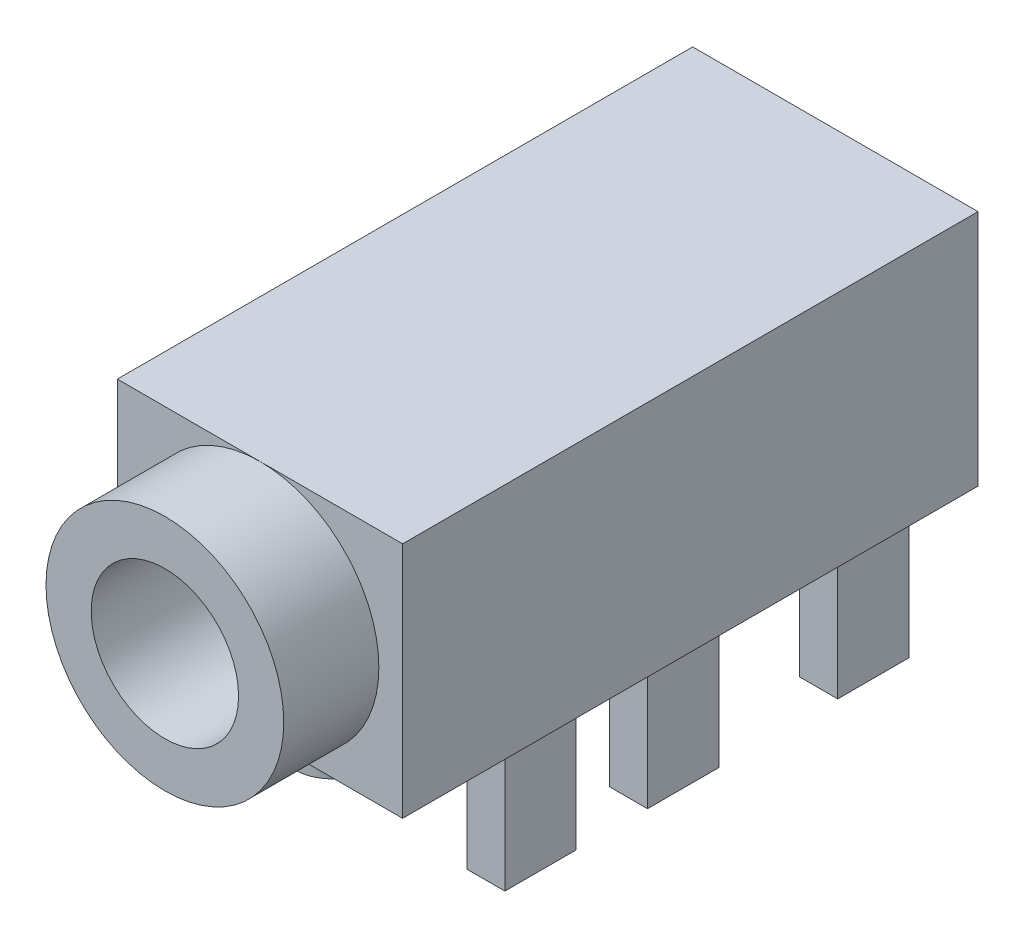
from build123d import *

# Parameters (mm, degrees)
SKETCH1_W           = 6
SKETCH1_H           = 12.1
BOSS_EXTRUDE1_DEPTH = 5
SKETCH2_R           = 2.5
BOSS_EXTRUDE2_DEPTH = 2
SKETCH4_W           = 0.8
SKETCH4_H           = 1.5
BOSS_EXTRUDE3_DEPTH = 2.8
SKETCH5_R           = 0.75
BOSS_EXTRUDE4_DEPTH = 1
SKETCH6_R           = 1.55
CUT_EXTRUDE1_DEPTH  = 10


with BuildPart() as part:
    # Sketch1 → Boss-Extrude1 (new body)
    with BuildSketch(Plane(origin=(0, 0, 0), x_dir=(1, 0, 0), z_dir=(0, 1, 0))):
        Rectangle(SKETCH1_W, SKETCH1_H)
    extrude(amount=BOSS_EXTRUDE1_DEPTH)

    # Sketch2 → Boss-Extrude2 (add)
    with BuildSketch(Plane.XY.offset(6.05)):
        with Locations(Location((0, 2.5, 0), (0, 0, 270))):
            Circle(SKETCH2_R)
    extrude(amount=BOSS_EXTRUDE2_DEPTH)

    # Sketch4 → Boss-Extrude3 (add)
    with BuildSketch(Plane.XZ):
        with Locations((2.2, 2.75)):
            Rectangle(SKETCH4_W, SKETCH4_H)
        with Locations((2.2, -0.25)):
            Rectangle(SKETCH4_W, SKETCH4_H)
        with Locations((2.2, -4.25)):
            Rectangle(SKETCH4_W, SKETCH4_H)
        with Locations((-2.2, -5.55)):
            Rectangle(SKETCH4_W, SKETCH4_H)
    extrude(amount=BOSS_EXTRUDE3_DEPTH)

    # Sketch5 → Boss-Extrude4 (add)
    with BuildSketch(Plane.XZ):
        with Locations(Location((0, 4.55, 0), (0, 0, 90))):
            Circle(SKETCH5_R)
        with Locations(Location((0, -2.45, 0), (0, 0, 90))):
            Circle(SKETCH5_R)
    extrude(amount=BOSS_EXTRUDE4_DEPTH)

    # Sketch6 → Cut-Extrude1 (cut)
    with BuildSketch(Plane.XY.offset(8.05)):
        with Locations((0, 2.5)):
            Circle(SKETCH6_R)
    extrude(amount=-CUT_EXTRUDE1_DEPTH, mode=Mode.SUBTRACT)


solid = part.part
